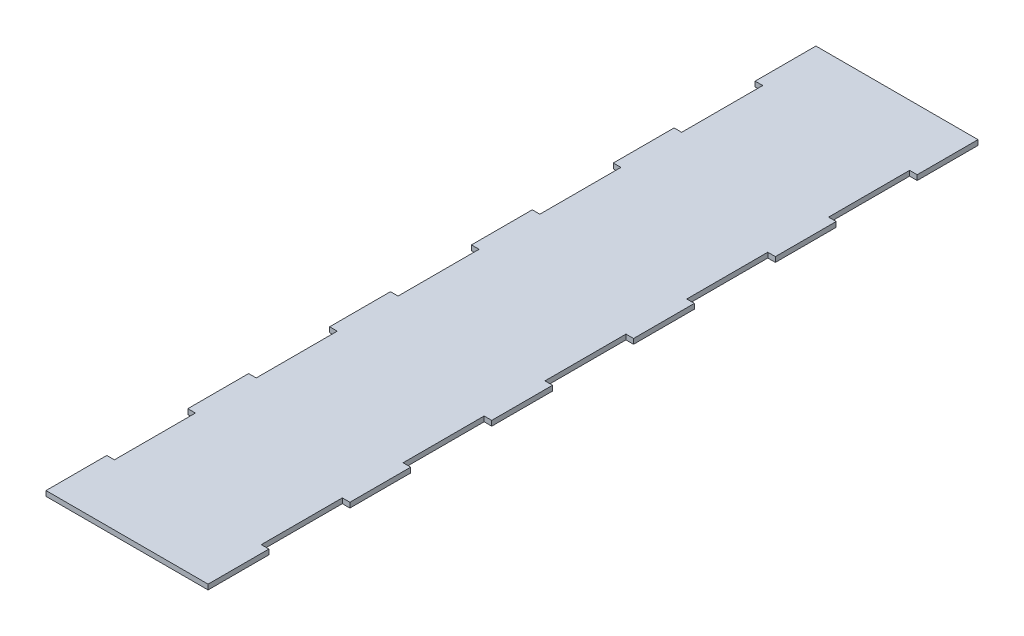
from build123d import *

# Parameters (mm, degrees)
BOSS_EXTRUDE1_DEPTH = 3.175


with BuildPart() as part:
    # Sketch1 → Boss-Extrude1 (new body)
    with BuildSketch(Plane(origin=(0, 0, 0), x_dir=(1, 0, 0), z_dir=(0, 1, 0))):
        Polygon((-50.8, 0), (50.8, 0), (50.8, 38.1), (46.0375, 38.1), (46.0375, 88.9), (50.8, 88.9), (50.8, 127), (46.0375, 127), (46.0375, 177.8), (50.8, 177.8), (50.8, 215.9), (46.0375, 215.9), (46.0375, 266.7), (50.8, 266.7), (50.8, 304.8), (46.0375, 304.8), (46.0375, 355.6), (50.8, 355.6), (50.8, 393.7), (46.0375, 393.7), (46.0375, 444.5), (50.8, 444.5), (50.8, 482.6), (-50.8, 482.6), (-50.8, 444.5), (-46.0375, 444.5), (-46.0375, 393.7), (-50.8, 393.7), (-50.8, 355.6), (-46.0375, 355.6), (-46.0375, 304.8), (-50.8, 304.8), (-50.8, 266.7), (-46.0375, 266.7), (-46.0375, 215.9), (-50.8, 215.9), (-50.8, 177.8), (-46.0375, 177.8), (-46.0375, 127), (-50.8, 127), (-50.8, 88.9), (-46.0375, 88.9), (-46.0375, 38.1), (-50.8, 38.1), align=None)
    extrude(amount=BOSS_EXTRUDE1_DEPTH)


solid = part.part
